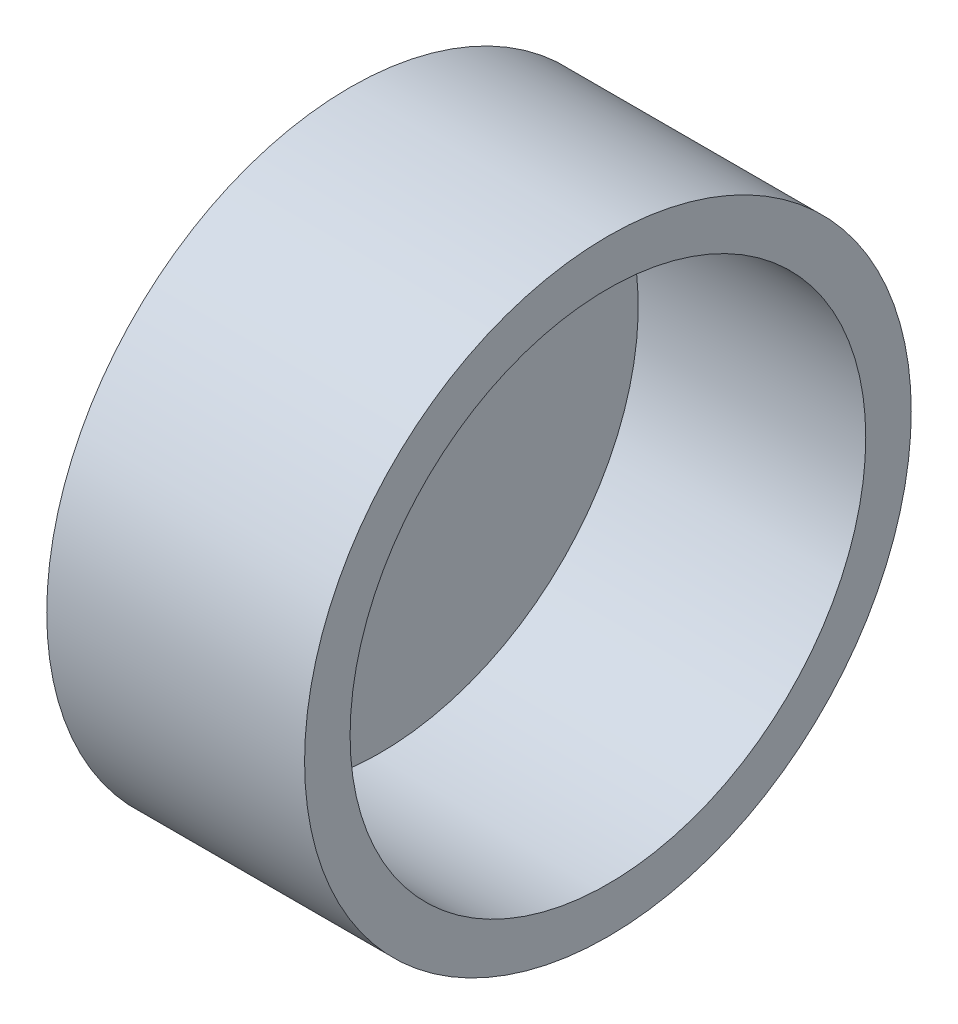
from build123d import *

# Parameters (mm, degrees)
SKETCH_1_R          = 10
SKETCH_1_R_2        = 8.5
EXTRUDE_1_DEPTH     = 8.5
SKETCH_2_R          = 8.5
EXTRUDE_2_DEPTH     = 1
SKETCH_7_R          = 1.5
CUT_EXTRUDE_3_DEPTH = 17.5


with BuildPart() as part:
    # ｽｹｯﾁ1 → ﾎﾞｽ - 押し出し1 (new body)
    with BuildSketch(Plane.YZ):
        with Locations(Location((0, 0, 0), (0, 0, 270))):
            Circle(SKETCH_1_R)
        with Locations(Location((0, 0, 0), (0, 0, 270))):
            Circle(SKETCH_1_R_2, mode=Mode.SUBTRACT)
    extrude(amount=EXTRUDE_1_DEPTH)

    # ｽｹｯﾁ2 → ﾎﾞｽ - 押し出し2 (add)
    with BuildSketch(Plane(origin=(0, 0, 0), x_dir=(0, -1, 0), z_dir=(-1, 0, 0))):
        with Locations(Location((0, 0, 0), (0, 0, 90))):
            Circle(SKETCH_2_R)
    extrude(amount=-EXTRUDE_2_DEPTH)

    # ｽｹｯﾁ7 → ｶｯﾄ - 押し出し3 (cut, through all)
    with BuildSketch(Plane(origin=(0, 0, 0), x_dir=(0, -1, 0), z_dir=(-1, 0, 0))):
        with Locations(Location((0, 0, 0), (0, 0, 90))):
            Circle(SKETCH_7_R)
    extrude(amount=-CUT_EXTRUDE_3_DEPTH, mode=Mode.SUBTRACT)


solid = part.part
